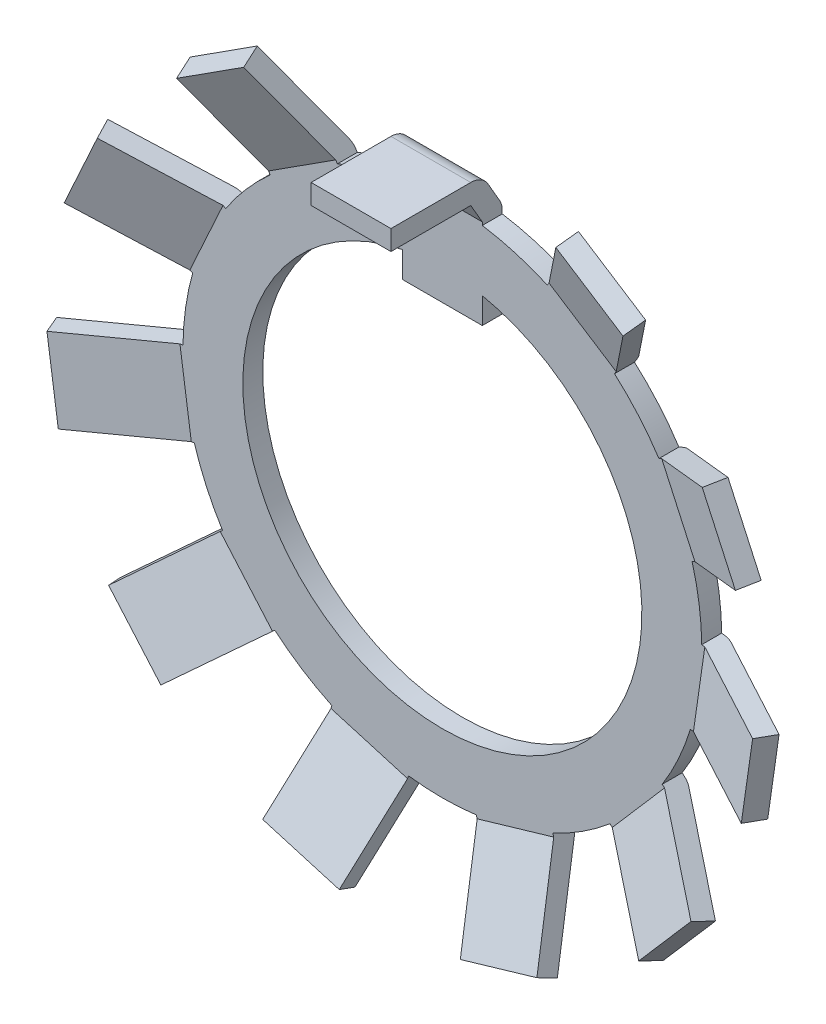
from build123d import *

# Parameters (mm, degrees)
ESQUISSE1_R                  = 13
BASE_EXTRUSION_DEPTH         = 1
BOSS_EXTRU_MINCE1_DEPTH      = 2
R_P_TITION_CIRCULAIRE1_COUNT = 10
R_P_TITION_CIRCULAIRE1_ANGLE = 294.545454545
BOSS_EXTRU_MINCE2_DEPTH      = 2


with BuildPart() as part:
    # Esquisse1 → Base-Extrusion (new body)
    with BuildSketch(Plane.XY):
        Circle(ESQUISSE1_R)
        with BuildLine():
            Line((-2, 8.5), (2, 8.5))
            Line((2, 8.5), (2, 9.797958971))
            ThreePointArc((2, 9.797958971), (0, -10), (-2, 9.797958971))
            Line((-2, 9.797958971), (-2, 8.5))
        make_face(mode=Mode.SUBTRACT)
    extrude(amount=BASE_EXTRUSION_DEPTH)

    # Esquisse2 → Boss.-Extru.-Mince1 (add, symmetric)
    with BuildSketch(Plane(origin=(0, 0, 0), x_dir=(-0.5406408174555986, 0.8412535328311805, 0), z_dir=(0.8412535328311805, 0.5406408174555986, 0))):
        with BuildLine():
            Line((10, 0), (13, 0))
            ThreePointArc((13, 0), (13.216439614, 0.023703993), (13.422618262, 0.093692213))
            Line((13.422618262, 0.093692213), (18, 2.228160372))
            Line((18, 2.228160372), (17.577381738, 3.134468159))
            Line((17.577381738, 3.134468159), (13, 1))
            Line((13, 1), (10, 1))
            Line((10, 1), (10, 0))
        make_face()
    boss_extru_mince1 = extrude(amount=BOSS_EXTRU_MINCE1_DEPTH, both=True)

    # Répétition circulaire1: Boss.-Extru.-Mince1 ×10 about axis
    r_p_tition_circulaire1_axis = Axis((0, 0, -7.805907173), (0, 0, 1))
    for i in range(1, R_P_TITION_CIRCULAIRE1_COUNT):
        add(boss_extru_mince1.rotate(r_p_tition_circulaire1_axis, i * R_P_TITION_CIRCULAIRE1_ANGLE / (R_P_TITION_CIRCULAIRE1_COUNT - 1)))

    # Esquisse3 → Boss.-Extru.-Mince2 (add, symmetric)
    with BuildSketch(Plane(origin=(0, 0, 0), x_dir=(0, 0, -1), z_dir=(1, 0, 0))):
        with BuildLine():
            Line((0, 10), (0, 13))
            ThreePointArc((0, 13), (-0.034074174, 13.258819045), (-0.133974596, 13.5))
            Line((-0.133974596, 13.5), (-0.711324865, 14.5))
            ThreePointArc((-0.711324865, 14.5), (-1.077350269, 14.866025404), (-1.577350269, 15))
            Line((-1.577350269, 15), (-5.577350269, 15))
            Line((-5.577350269, 15), (-5.577350269, 14))
            Line((-5.577350269, 14), (-1.577350269, 14))
            Line((-1.577350269, 14), (-1, 13))
            Line((-1, 13), (-1, 10))
            Line((-1, 10), (0, 10))
        make_face()
    extrude(amount=BOSS_EXTRU_MINCE2_DEPTH, both=True)


solid = part.part
